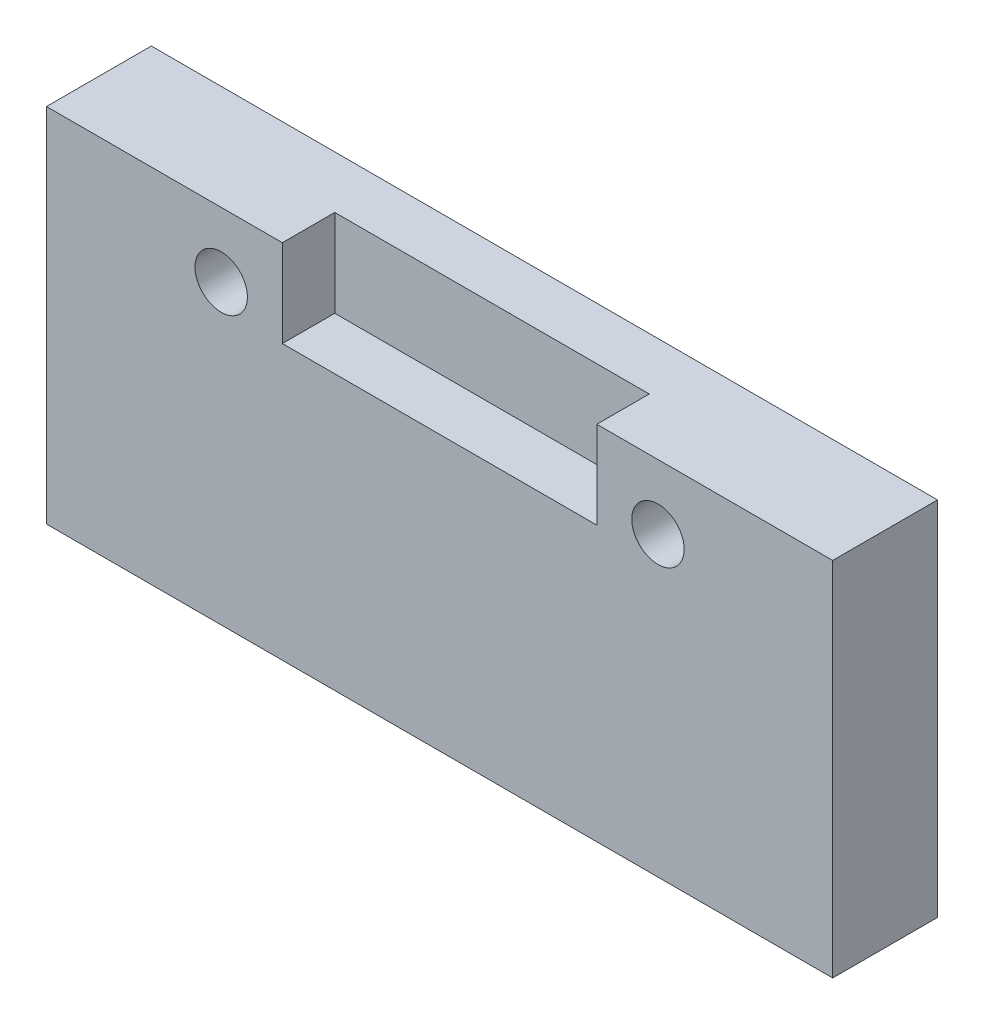
from build123d import *

# Parameters (mm, degrees)
SKETCH1_W           = 45
SKETCH1_H           = 20.7
SKETCH1_R           = 1.5
BOSS_EXTRUDE1_DEPTH = 6
SKETCH3_W           = 18
SKETCH3_H           = 5
CUT_EXTRUDE1_DEPTH  = 3


with BuildPart() as part:
    # Sketch1 → Boss-Extrude1 (new body)
    with BuildSketch(Plane.XY):
        with Locations((4.046614158, 1.856007179)):
            Rectangle(SKETCH1_W, SKETCH1_H)
        with Locations((16.546614158, 8.506007179)):
            Circle(SKETCH1_R, mode=Mode.SUBTRACT)
        with Locations((-8.453385842, 8.506007179)):
            Circle(SKETCH1_R, mode=Mode.SUBTRACT)
    extrude(amount=BOSS_EXTRUDE1_DEPTH)

    # Sketch3 → Cut-Extrude1 (cut)
    with BuildSketch(Plane.XY.offset(6)):
        with Locations((4.046614158, 9.706007179)):
            Rectangle(SKETCH3_W, SKETCH3_H)
    extrude(amount=-CUT_EXTRUDE1_DEPTH, mode=Mode.SUBTRACT)


solid = part.part
